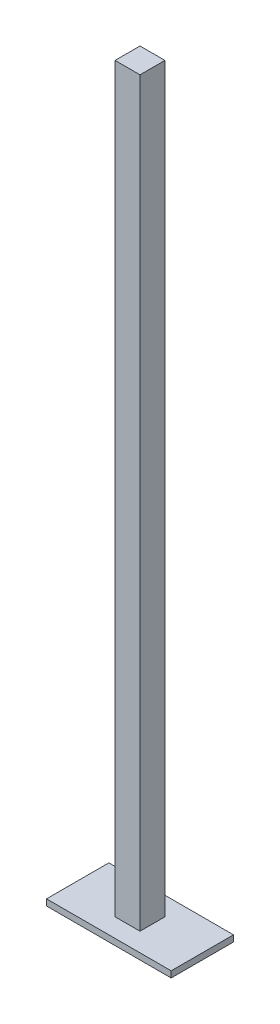
from build123d import *

# Parameters (mm, degrees)
SKETCH1_W      = 100
SKETCH1_H      = 50
EXTRUDE1_DEPTH = 5
SKETCH2_W      = 20
SKETCH2_H      = 20
EXTRUDE2_DEPTH = 600


with BuildPart() as part:
    # Sketch1 → Extrude1 (new body)
    with BuildSketch(Plane(origin=(0, 0, 0), x_dir=(1, 0, 0), z_dir=(0, 1, 0))):
        Rectangle(SKETCH1_W, SKETCH1_H)
    extrude(amount=EXTRUDE1_DEPTH)

    # Sketch2 → Extrude2 (add)
    with BuildSketch(Plane(origin=(0, 0, 0), x_dir=(1, 0, 0), z_dir=(0, 1, 0))):
        Rectangle(SKETCH2_W, SKETCH2_H)
    extrude(amount=EXTRUDE2_DEPTH)


solid = part.part
